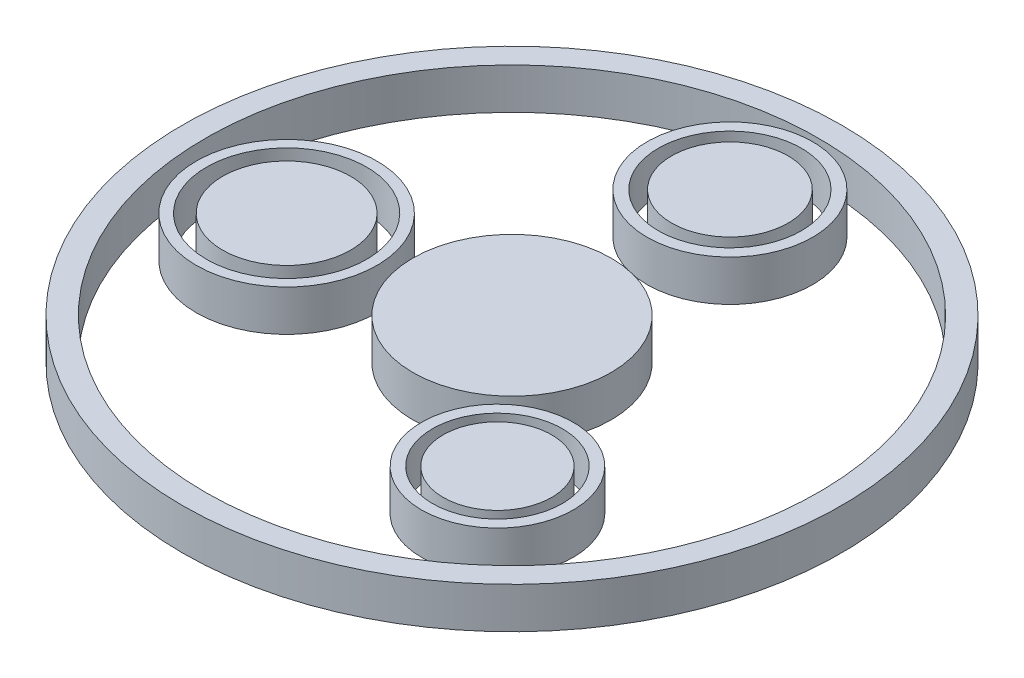
from build123d import *

# Parameters (mm, degrees)
SKETCH1_R             = 80.222638377
SKETCH1_R_2           = 74.642628995
BOSS_EXTRUDE1_DEPTH   = 10
SKETCH1_R_3           = 24.134997674
BOSS_EXTRUDE1_2_DEPTH = 10
SKETCH1_R_4           = 15.576395098
BOSS_EXTRUDE1_3_DEPTH = 10
SKETCH1_R_5           = 22.002030522
SKETCH1_R_6           = 19.479844266
BOSS_EXTRUDE1_4_DEPTH = 10
SKETCH1_R_7           = 14.181155463
BOSS_EXTRUDE1_5_DEPTH = 10
SKETCH1_R_8           = 20.152350334
SKETCH1_R_9           = 17.415889713
BOSS_EXTRUDE1_6_DEPTH = 10
SKETCH1_R_10          = 13.203023979
BOSS_EXTRUDE1_7_DEPTH = 10
SKETCH1_R_11          = 18.477604897
SKETCH1_R_12          = 15.801149957
BOSS_EXTRUDE1_8_DEPTH = 10


with BuildPart() as part:
    # Sketch1 → Boss-Extrude1 (new body)
    with BuildSketch(Plane(origin=(0, 0, 0), x_dir=(1, 0, 0), z_dir=(0, 1, 0))):
        with Locations(Location((0, 0, 0), (0, 0, 270))):
            Circle(SKETCH1_R)
        with Locations(Location((0, 0, 0), (0, 0, 270))):
            Circle(SKETCH1_R_2, mode=Mode.SUBTRACT)
    extrude(amount=BOSS_EXTRUDE1_DEPTH)


with BuildPart() as body_2:
    # Sketch1 → Boss-Extrude1 2 (new body)
    with BuildSketch(Plane(origin=(0, 0, 0), x_dir=(1, 0, 0), z_dir=(0, 1, 0))):
        with Locations(Location((0, 0, 0), (0, 0, 270))):
            Circle(SKETCH1_R_3)
    extrude(amount=BOSS_EXTRUDE1_2_DEPTH)


with BuildPart() as body_3:
    # Sketch1 → Boss-Extrude1 3 (new body)
    with BuildSketch(Plane(origin=(0, 0, 0), x_dir=(1, 0, 0), z_dir=(0, 1, 0))):
        with Locations(Location((-48.947047963, -5.913676799, 0), (0, 0, 270))):
            Circle(SKETCH1_R_4)
    extrude(amount=BOSS_EXTRUDE1_3_DEPTH)


with BuildPart() as body_4:
    # Sketch1 → Boss-Extrude1 4 (new body)
    with BuildSketch(Plane(origin=(0, 0, 0), x_dir=(1, 0, 0), z_dir=(0, 1, 0))):
        with Locations(Location((-48.947047963, -5.913676799, 0), (0, 0, 270))):
            Circle(SKETCH1_R_5)
        with Locations(Location((-48.947047963, -5.913676799, 0), (0, 0, 270))):
            Circle(SKETCH1_R_6, mode=Mode.SUBTRACT)
    extrude(amount=BOSS_EXTRUDE1_4_DEPTH)


with BuildPart() as body_5:
    # Sketch1 → Boss-Extrude1 5 (new body)
    with BuildSketch(Plane(origin=(0, 0, 0), x_dir=(1, 0, 0), z_dir=(0, 1, 0))):
        with Locations(Location((0, 53.041131901, 0), (0, 0, 270))):
            Circle(SKETCH1_R_7)
    extrude(amount=BOSS_EXTRUDE1_5_DEPTH)


with BuildPart() as body_6:
    # Sketch1 → Boss-Extrude1 6 (new body)
    with BuildSketch(Plane(origin=(0, 0, 0), x_dir=(1, 0, 0), z_dir=(0, 1, 0))):
        with Locations(Location((0, 53.041131901, 0), (0, 0, 270))):
            Circle(SKETCH1_R_8)
        with Locations(Location((0, 53.041131901, 0), (0, 0, 270))):
            Circle(SKETCH1_R_9, mode=Mode.SUBTRACT)
    extrude(amount=BOSS_EXTRUDE1_6_DEPTH)


with BuildPart() as body_7:
    # Sketch1 → Boss-Extrude1 7 (new body)
    with BuildSketch(Plane(origin=(0, 0, 0), x_dir=(1, 0, 0), z_dir=(0, 1, 0))):
        with Locations(Location((30.023282208, -33.571488287, 0), (0, 0, 270))):
            Circle(SKETCH1_R_10)
    extrude(amount=BOSS_EXTRUDE1_7_DEPTH)


with BuildPart() as body_8:
    # Sketch1 → Boss-Extrude1 8 (new body)
    with BuildSketch(Plane(origin=(0, 0, 0), x_dir=(1, 0, 0), z_dir=(0, 1, 0))):
        with Locations(Location((30.023282208, -33.571488287, 0), (0, 0, 270))):
            Circle(SKETCH1_R_11)
        with Locations(Location((30.023282208, -33.571488287, 0), (0, 0, 270))):
            Circle(SKETCH1_R_12, mode=Mode.SUBTRACT)
    extrude(amount=BOSS_EXTRUDE1_8_DEPTH)


solid = Compound([part.part, body_2.part, body_3.part, body_4.part, body_5.part, body_6.part, body_7.part, body_8.part])
